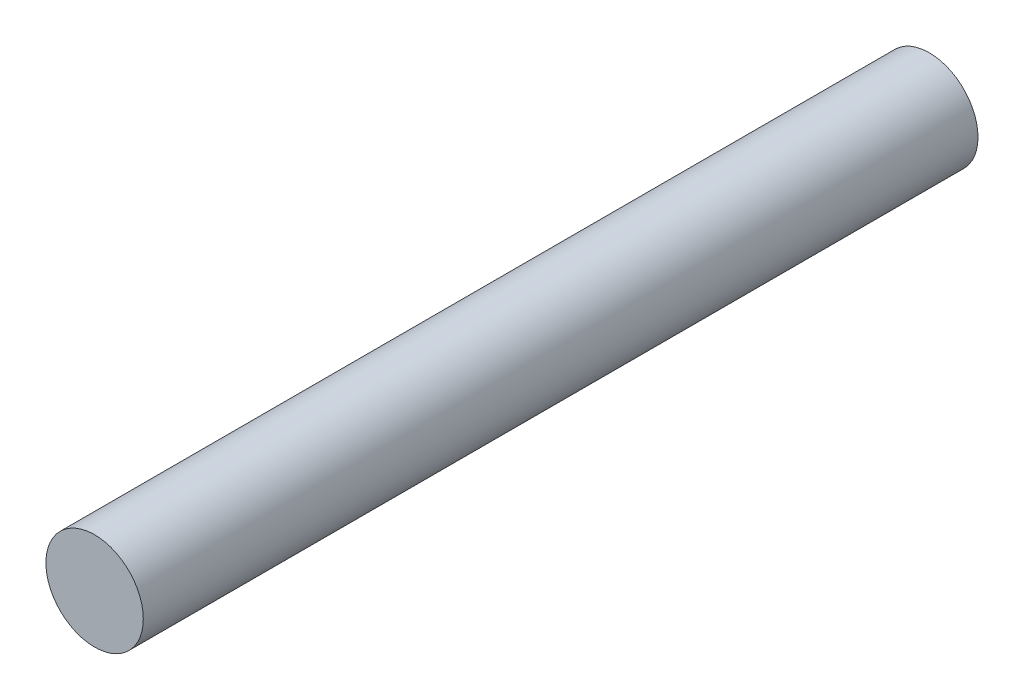
from build123d import *

# Parameters (mm, degrees)
SKETCH1_R           = 3.5
BOSS_EXTRUDE1_DEPTH = 30


with BuildPart() as part:
    # Sketch1 → Boss-Extrude1 (new, symmetric)
    with BuildSketch(Plane.XY):
        Circle(SKETCH1_R)
    extrude(amount=BOSS_EXTRUDE1_DEPTH, both=True)


solid = part.part
